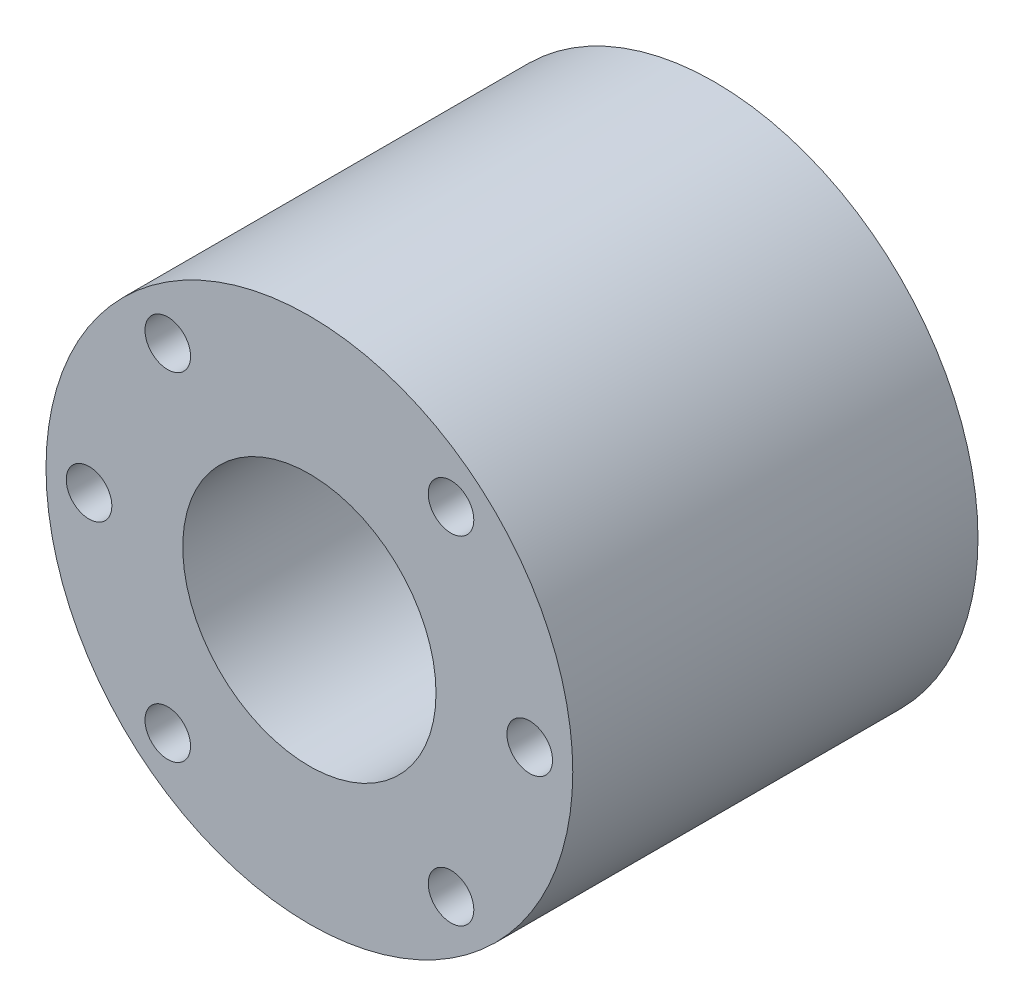
from build123d import *

# Parameters (mm, degrees)
SKETCH_1_R          = 26
SKETCH_1_R_2        = 2.25
EXTRUDE_1_DEPTH     = 40
SKETCH_2_R          = 12.5
CUT_EXTRUDE_1_DEPTH = 55.332310829


with BuildPart() as part:
    # 草图1 → 凸台-拉伸1 (new body)
    with BuildSketch(Plane.XY):
        Circle(SKETCH_1_R)
        with Locations((-21.75, 0)):
            Circle(SKETCH_1_R_2, mode=Mode.SUBTRACT)
        with Locations((-13.980630511, 16.661466638)):
            Circle(SKETCH_1_R_2, mode=Mode.SUBTRACT)
        with Locations((-13.980630511, -16.661466638)):
            Circle(SKETCH_1_R_2, mode=Mode.SUBTRACT)
        with Locations((13.980630511, -16.661466638)):
            Circle(SKETCH_1_R_2, mode=Mode.SUBTRACT)
        with Locations((21.75, 0)):
            Circle(SKETCH_1_R_2, mode=Mode.SUBTRACT)
        with Locations((13.980630511, 16.661466638)):
            Circle(SKETCH_1_R_2, mode=Mode.SUBTRACT)
    extrude(amount=EXTRUDE_1_DEPTH)

    # 草图2 → 切除-拉伸1 (cut, through all)
    with BuildSketch(Plane.XY.offset(40)):
        Circle(SKETCH_2_R)
    extrude(amount=-CUT_EXTRUDE_1_DEPTH, mode=Mode.SUBTRACT)


solid = part.part
